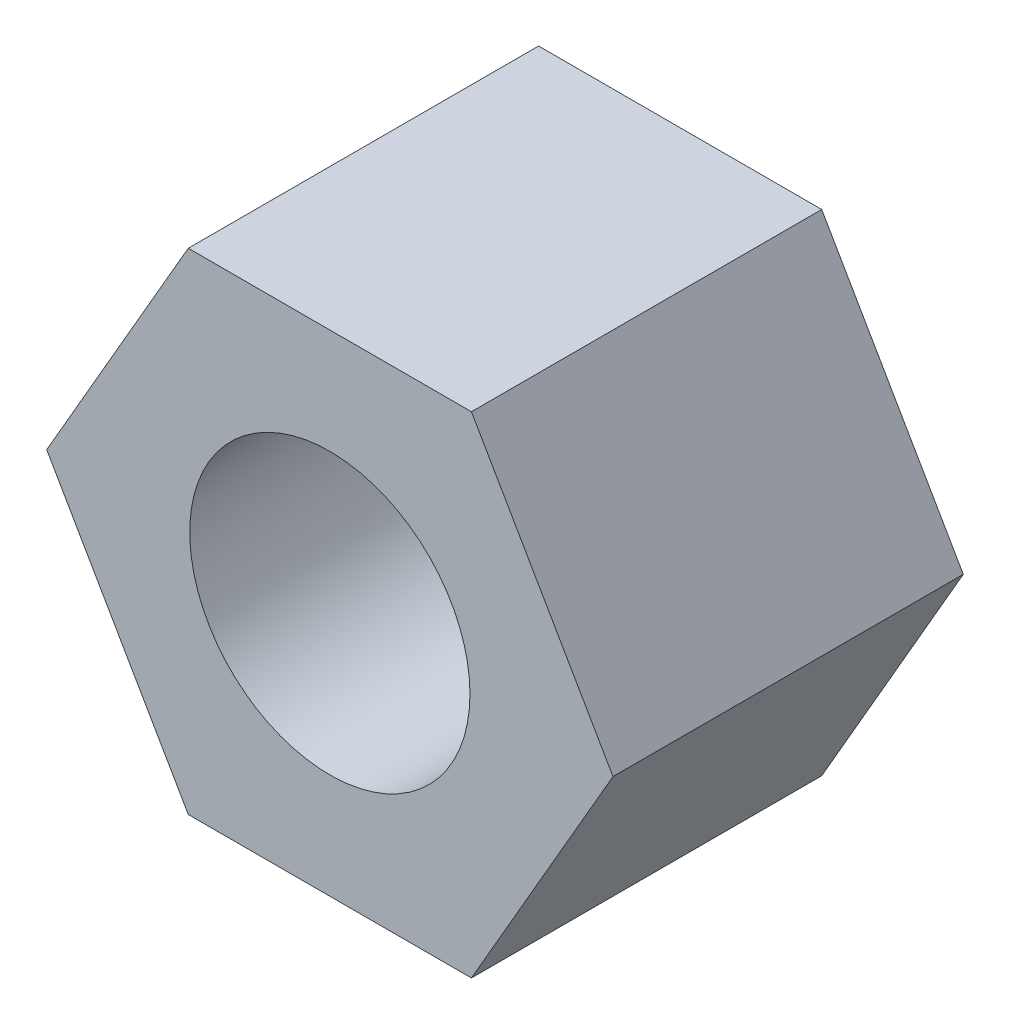
from build123d import *

# Parameters (mm, degrees)
SKETCH1_R                           = 2
LOCKNUT_CONSERVATIVE_ENVELOPE_DEPTH = 5


with BuildPart() as part:
    # Sketch1 → Locknut_Conservative_Envelope (new body)
    with BuildSketch(Plane.XY):
        Polygon((4.041451884, 0), (2.020725942, 3.5), (-2.020725942, 3.5), (-4.041451884, 0), (-2.020725942, -3.5), (2.020725942, -3.5), align=None)
        Circle(SKETCH1_R, mode=Mode.SUBTRACT)
    extrude(amount=LOCKNUT_CONSERVATIVE_ENVELOPE_DEPTH)


solid = part.part
